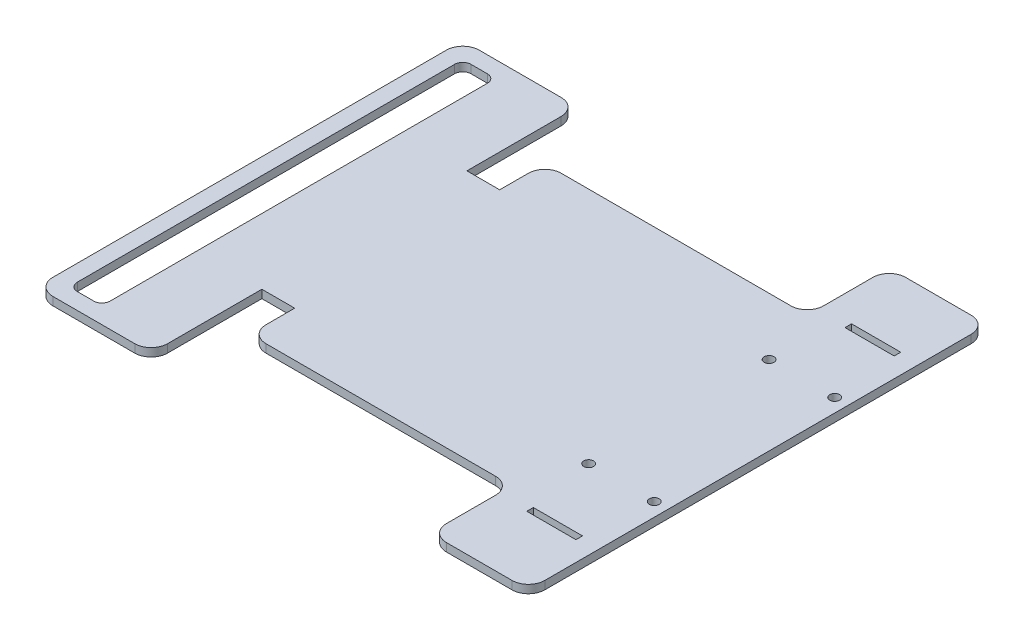
from build123d import *

# Parameters (mm, degrees)
BOSS_EXTRUDE1_DEPTH = 2.5
SKETCH2_R           = 1.5
CUT_EXTRUDE1_DEPTH  = 106.920143167
SKETCH4_W           = 15
SKETCH4_H           = 2
CUT_EXTRUDE2_DEPTH  = 2.5


with BuildPart() as part:
    # Sketch1 → Boss-Extrude1 (new body)
    with BuildSketch(Plane(origin=(0, 0, 0), x_dir=(1, 0, 0), z_dir=(0, 1, 0))):
        with BuildLine():
            Line((45.546700959, 65), (45.546700959, 49.998256331))
            ThreePointArc((45.546700959, 49.998256331), (44.082234865, 46.462722425), (40.546700959, 44.998256331))
            Line((40.546700959, 44.998256331), (-29.453299041, 44.998256331))
            ThreePointArc((-29.453299041, 44.998256331), (-32.988832947, 43.533790237), (-34.453299041, 39.998256331))
            Line((-34.453299041, 39.998256331), (-34.453299041, 31.248256331))
            Line((-34.453299041, 31.248256331), (-44.453299041, 31.248256331))
            Line((-44.453299041, 31.248256331), (-44.453299041, 46.248256331))
            Line((-44.453299041, 46.248256331), (-44.453299041, 60))
            ThreePointArc((-44.453299041, 60), (-45.917765135, 63.535533906), (-49.453299041, 65))
            Line((-49.453299041, 65), (-74.453299041, 65))
            ThreePointArc((-74.453299041, 65), (-77.988832947, 63.535533906), (-79.453299041, 60))
            Line((-79.453299041, 60), (-79.453299041, -60))
            ThreePointArc((-79.453299041, -60), (-77.988832947, -63.535533906), (-74.453299041, -65))
            Line((-74.453299041, -65), (-49.453299041, -65))
            ThreePointArc((-49.453299041, -65), (-45.917765135, -63.535533906), (-44.453299041, -60))
            Line((-44.453299041, -60), (-44.453299041, -46.251743669))
            Line((-44.453299041, -46.251743669), (-44.453299041, -31.251743669))
            Line((-44.453299041, -31.251743669), (-34.453299041, -31.251743669))
            Line((-34.453299041, -31.251743669), (-34.453299041, -40.001743669))
            ThreePointArc((-34.453299041, -40.001743669), (-32.988832947, -43.537277575), (-29.453299041, -45.001743669))
            Line((-29.453299041, -45.001743669), (40.546700959, -45.001743669))
            ThreePointArc((40.546700959, -45.001743669), (44.082234865, -46.466209763), (45.546700959, -50.001743669))
            Line((45.546700959, -50.001743669), (45.546700959, -65))
            ThreePointArc((45.546700959, -65), (47.011167053, -68.535533906), (50.546700959, -70))
            Line((50.546700959, -70), (70.546700959, -70))
            ThreePointArc((70.546700959, -70), (74.082234865, -68.535533906), (75.546700959, -65))
            Line((75.546700959, -65), (75.546700959, 65))
            ThreePointArc((75.546700959, 65), (74.082234865, 68.535533906), (70.546700959, 70))
            Line((70.546700959, 70), (50.546700959, 70))
            ThreePointArc((50.546700959, 70), (47.011167053, 68.535533906), (45.546700959, 65))
        make_face()
        with BuildLine():
            Line((-71.953299041, 60), (-66.953299041, 60))
            ThreePointArc((-66.953299041, 60), (-65.185532088, 59.267766953), (-64.453299041, 57.5))
            Line((-64.453299041, 57.5), (-64.453299041, -57.5))
            ThreePointArc((-64.453299041, -57.5), (-65.185532088, -59.267766953), (-66.953299041, -60))
            Line((-66.953299041, -60), (-71.953299041, -60))
            ThreePointArc((-71.953299041, -60), (-73.721065994, -59.267766953), (-74.453299041, -57.5))
            Line((-74.453299041, -57.5), (-74.453299041, 57.5))
            ThreePointArc((-74.453299041, 57.5), (-73.721065994, 59.267766953), (-71.953299041, 60))
        make_face(mode=Mode.SUBTRACT)
    extrude(amount=BOSS_EXTRUDE1_DEPTH)

    # Sketch2 → Cut-Extrude1 (cut, through all)
    with BuildSketch(Plane(origin=(0, 2.5, 0), x_dir=(1, 0, 0), z_dir=(0, 1, 0))):
        with Locations(Location((51.417773874, 27.5, 0), (0, 0, 270))):
            Circle(SKETCH2_R)
        with Locations(Location((51.417773874, -27.5, 0), (0, 0, 270))):
            Circle(SKETCH2_R)
        with Locations(Location((71.417773874, -27.5, 0), (0, 0, 270))):
            Circle(SKETCH2_R)
        with Locations(Location((71.417773874, 27.5, 0), (0, 0, 270))):
            Circle(SKETCH2_R)
    extrude(amount=-CUT_EXTRUDE1_DEPTH, mode=Mode.SUBTRACT)

    # Sketch4 → Cut-Extrude2 (cut)
    with BuildSketch(Plane.XZ):
        with Locations((62.046700959, -48.5)):
            Rectangle(SKETCH4_W, SKETCH4_H)
        with Locations((62.046700959, 48.5)):
            Rectangle(SKETCH4_W, SKETCH4_H)
    extrude(amount=-CUT_EXTRUDE2_DEPTH, mode=Mode.SUBTRACT)


solid = part.part
